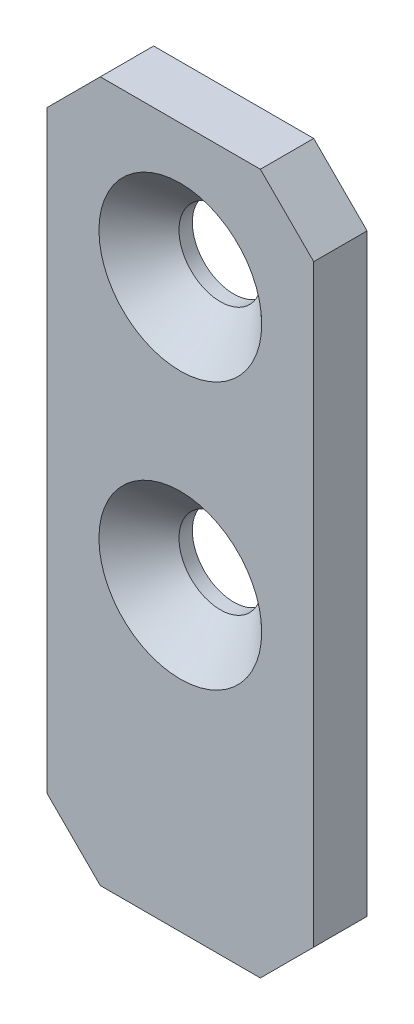
from build123d import *

# Parameters (mm, degrees)
SKETCH_1_W      = 20
SKETCH_1_H      = 52.5
SKETCH_1_R      = 3.1
EXTRUDE_1_DEPTH = 2
CHAMFER_1_SIZE  = 4
CHAMFER_2_SIZE  = 3


with BuildPart() as part:
    # 草图1 → 凸台-拉伸1 (new, symmetric)
    with BuildSketch(Plane.XY):
        Rectangle(SKETCH_1_W, SKETCH_1_H)
        with Locations((0, 16.25)):
            Circle(SKETCH_1_R, mode=Mode.SUBTRACT)
        with Locations((0, -3.75)):
            Circle(SKETCH_1_R, mode=Mode.SUBTRACT)
    extrude(amount=EXTRUDE_1_DEPTH, both=True)

    # 倒角1
    chamfer_1_edges = [part.edges().sort_by_distance(p)[0] for p in [
        (-10, 26.25, 0),
        (10, 26.25, 0),
        (10, -26.25, 0),
        (-10, -26.25, 0),
    ]]
    chamfer(chamfer_1_edges, length=CHAMFER_1_SIZE)

    # 倒角2
    chamfer_2_edges = [part.edges().sort_by_distance(p)[0] for p in [
        (-3.1, 16.25, 2),
        (-3.1, -3.75, 2),
    ]]
    chamfer(chamfer_2_edges, length=CHAMFER_2_SIZE)


solid = part.part
